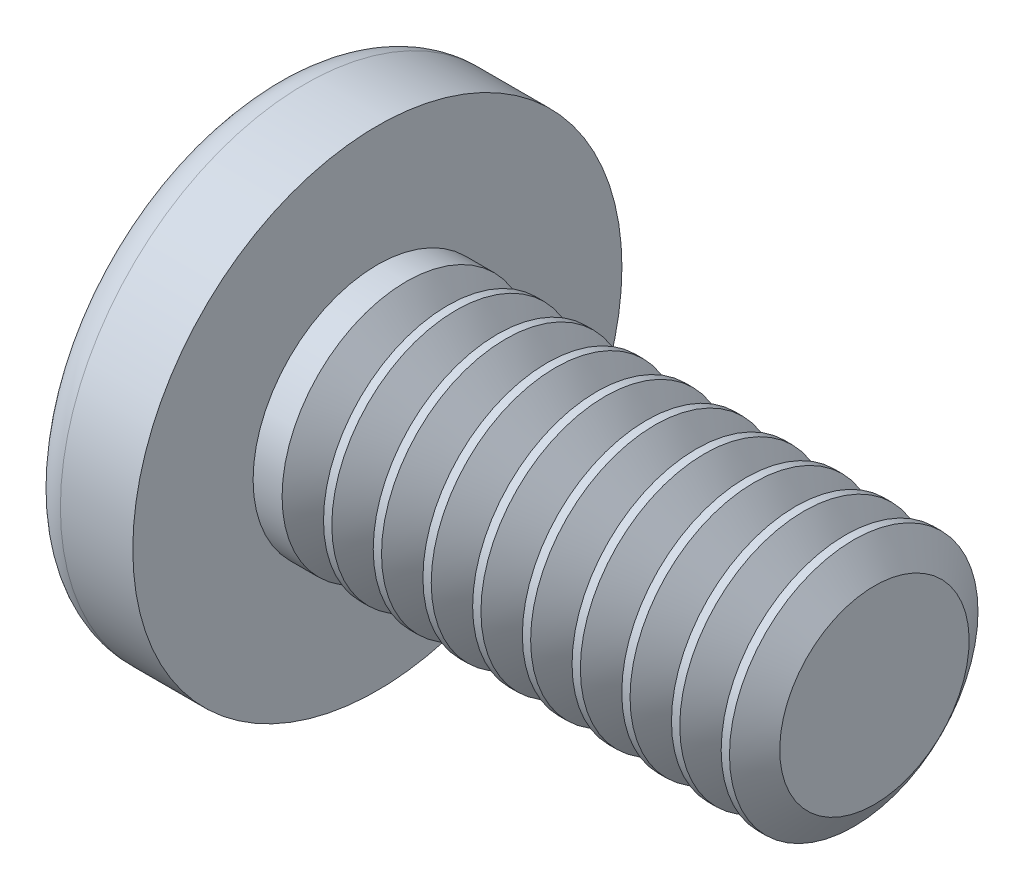
from build123d import *

# Parameters (mm, degrees)
CIRPATTERN1_COUNT = 2
CIRPATTERN1_ANGLE = 90
THDSCHPAT_COUNT   = 10
THDSCHPAT_PITCH   = 1.27


with BuildPart() as part:
    # BodySke → Base-Revolve (revolve)
    with BuildSketch(Plane.XY, mode=Mode.PRIVATE) as base_revolve_sk:
        with BuildLine():
            Line((4.445, 3.175), (4.445, 6.2484))
            Line((4.445, 6.2484), (2.595062945, 6.2484))
            ThreePointArc((2.595062945, 6.2484), (2.186742909, 6.149080789), (1.869658022, 5.873315068))
            ThreePointArc((1.869658022, 5.873315068), (0.478691346, 3.081860275), (0, 0))
            Line((0, 0), (17.145, 0))
            Line((17.145, 0), (17.145, 3.175))
            Line((17.145, 3.175), (4.445, 3.175))
        make_face()
    revolve(base_revolve_sk.sketch.rotate(Axis((-25.4, 0, 0), (1, 0, 0)), 90), axis=Axis((-25.4, 0, 0), (1, 0, 0)))

    # Sketch3 → Cut-Loft1 section 0
    with BuildSketch(Plane(origin=(0, 0, 0), x_dir=(0, 0, -1), z_dir=(1, 0, 0))):
        with BuildLine():
            Line((0.7366, -4.0386), (-0.7366, -4.0386))
            Line((-0.7366, -4.0386), (-0.7366, 4.0386))
            Line((-0.7366, 4.0386), (0.7366, 4.0386))
            Line((0.7366, 4.0386), (0.7366, -4.0386))
        make_face()
    # Sketch4 → Cut-Loft1 section 1
    with BuildSketch(Plane(origin=(4.572, 0, 0), x_dir=(0, 0, -1), z_dir=(1, 0, 0))):
        with BuildLine():
            Line((0.3683, -0.3683), (-0.3683, -0.3683))
            Line((-0.3683, -0.3683), (-0.3683, 0.3683))
            Line((-0.3683, 0.3683), (0.3683, 0.3683))
            Line((0.3683, 0.3683), (0.3683, -0.3683))
        make_face()
    cut_loft1 = loft(mode=Mode.SUBTRACT)

    # CirPattern1: Cut-Loft1 ×2 about axis
    cirpattern1_axis = Axis((0, 0, 0), (1, 0, 0))
    for i in range(1, CIRPATTERN1_COUNT):
        add(cut_loft1.rotate(cirpattern1_axis, i * CIRPATTERN1_ANGLE / (CIRPATTERN1_COUNT - 1)), mode=Mode.SUBTRACT)

    # ThdSchSke → ThreadSchematic (revolve, cut)
    with BuildSketch(Plane.XY, mode=Mode.PRIVATE) as threadschematic_sk:
        Polygon((5.715, -2.41935), (5.185888174, -3.175), (5.185888174, -3.96875), (6.244111826, -3.96875), (6.244111826, -3.175), align=None)
    threadschematic = revolve(threadschematic_sk.sketch.rotate(Axis((-3.175, 0, 0), (1, 0, 0)), 270), axis=Axis((-3.175, 0, 0), (1, 0, 0)), mode=Mode.SUBTRACT)

    # ThdSchPat: ThreadSchematic ×10
    with Locations(*[(i * THDSCHPAT_PITCH, 0, 0) for i in range(1, THDSCHPAT_COUNT)]):
        add(threadschematic, mode=Mode.SUBTRACT)


solid = part.part
